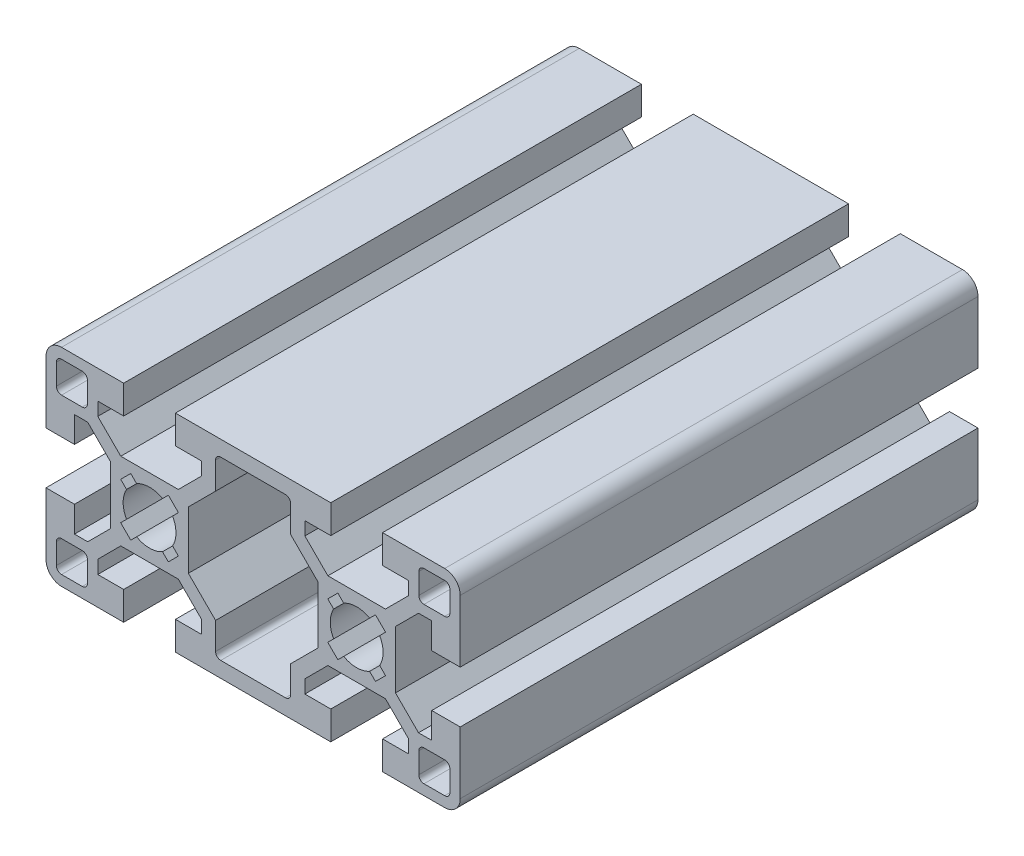
from build123d import *

# Parameters (mm, degrees)
BOSS_EXTRUDE1_DEPTH = 50


with BuildPart() as part:
    # Sketch1 → Boss-Extrude1 (new, symmetric)
    with BuildSketch(Plane.XY):
        with BuildLine():
            Line((-15, -20), (15, -20))
            Line((15, -20), (15, -14.5))
            Line((15, -14.5), (10, -14.5))
            Line((10, -14.5), (10, -11.944543648))
            Line((10, -11.944543648), (14.444543648, -7.5))
            Line((14.444543648, -7.5), (25.555456352, -7.5))
            Line((25.555456352, -7.5), (30, -11.944543648))
            Line((30, -11.944543648), (30, -14.5))
            Line((30, -14.5), (25, -14.5))
            Line((25, -14.5), (25, -20))
            Line((25, -20), (37, -20))
            ThreePointArc((37, -20), (39.121320344, -19.121320344), (40, -17))
            Line((40, -17), (40, -5))
            Line((40, -5), (34.5, -5))
            Line((34.5, -5), (34.5, -10))
            Line((34.5, -10), (31.944543648, -10))
            Line((31.944543648, -10), (27.5, -5.555456352))
            Line((27.5, -5.555456352), (27.5, 5.555456352))
            Line((27.5, 5.555456352), (31.944543648, 10))
            Line((31.944543648, 10), (34.5, 10))
            Line((34.5, 10), (34.5, 5))
            Line((34.5, 5), (40, 5))
            Line((40, 5), (40, 17))
            ThreePointArc((40, 17), (39.121320344, 19.121320344), (37, 20))
            Line((37, 20), (25, 20))
            Line((25, 20), (25, 14.5))
            Line((25, 14.5), (30, 14.5))
            Line((30, 14.5), (30, 11.944543648))
            Line((30, 11.944543648), (25.555456352, 7.5))
            Line((25.555456352, 7.5), (14.444543648, 7.5))
            Line((14.444543648, 7.5), (10, 11.944543648))
            Line((10, 11.944543648), (10, 14.5))
            Line((10, 14.5), (15, 14.5))
            Line((15, 14.5), (15, 20))
            Line((15, 20), (-15, 20))
            Line((-15, 20), (-15, 14.5))
            Line((-15, 14.5), (-10, 14.5))
            Line((-10, 14.5), (-10, 11.944543648))
            Line((-10, 11.944543648), (-14.444543648, 7.5))
            Line((-14.444543648, 7.5), (-25.555456352, 7.5))
            Line((-25.555456352, 7.5), (-30, 11.944543648))
            Line((-30, 11.944543648), (-30, 14.5))
            Line((-30, 14.5), (-25, 14.5))
            Line((-25, 14.5), (-25, 20))
            Line((-25, 20), (-37, 20))
            ThreePointArc((-37, 20), (-39.121320344, 19.121320344), (-40, 17))
            Line((-40, 17), (-40, 5))
            Line((-40, 5), (-34.5, 5))
            Line((-34.5, 5), (-34.5, 10))
            Line((-34.5, 10), (-31.944543648, 10))
            Line((-31.944543648, 10), (-27.5, 5.555456352))
            Line((-27.5, 5.555456352), (-27.5, -5.555456352))
            Line((-27.5, -5.555456352), (-31.944543648, -10))
            Line((-31.944543648, -10), (-34.5, -10))
            Line((-34.5, -10), (-34.5, -5))
            Line((-34.5, -5), (-40, -5))
            Line((-40, -5), (-40, -17))
            ThreePointArc((-40, -17), (-39.121320344, -19.121320344), (-37, -20))
            Line((-37, -20), (-25, -20))
            Line((-25, -20), (-25, -14.5))
            Line((-25, -14.5), (-30, -14.5))
            Line((-30, -14.5), (-30, -11.944543648))
            Line((-30, -11.944543648), (-25.555456352, -7.5))
            Line((-25.555456352, -7.5), (-14.444543648, -7.5))
            Line((-14.444543648, -7.5), (-10, -11.944543648))
            Line((-10, -11.944543648), (-10, -14.5))
            Line((-10, -14.5), (-15, -14.5))
            Line((-15, -14.5), (-15, -20))
        make_face()
        with BuildLine():
            Line((-38, 13), (-38, 17))
            ThreePointArc((-38, 17), (-37.707106781, 17.707106781), (-37, 18))
            Line((-37, 18), (-33, 18))
            ThreePointArc((-33, 18), (-32.292893219, 17.707106781), (-32, 17))
            Line((-32, 17), (-32, 13))
            ThreePointArc((-32, 13), (-32.292893219, 12.292893219), (-33, 12))
            Line((-33, 12), (-37, 12))
            ThreePointArc((-37, 12), (-37.707106781, 12.292893219), (-38, 13))
        make_face(mode=Mode.SUBTRACT)
        with BuildLine():
            Line((-15.555022098, -2.500434253), (-14.423651249, -3.631805103))
            Line((-14.423651249, -3.631805103), (-16.368194897, -5.576348751))
            Line((-16.368194897, -5.576348751), (-17.499565747, -4.444977902))
            ThreePointArc((-17.499565747, -4.444977902), (-20, -5.1), (-22.500434253, -4.444977902))
            Line((-22.500434253, -4.444977902), (-23.631805103, -5.576348751))
            Line((-23.631805103, -5.576348751), (-25.576348751, -3.631805103))
            Line((-25.576348751, -3.631805103), (-24.444977902, -2.500434253))
            ThreePointArc((-24.444977902, -2.500434253), (-25.1, 0), (-24.444977902, 2.500434253))
            Line((-24.444977902, 2.500434253), (-25.576348751, 3.631805103))
            Line((-25.576348751, 3.631805103), (-23.631805103, 5.576348751))
            Line((-23.631805103, 5.576348751), (-22.500434253, 4.444977902))
            ThreePointArc((-22.500434253, 4.444977902), (-20, 5.1), (-17.499565747, 4.444977902))
            Line((-17.499565747, 4.444977902), (-16.368194897, 5.576348751))
            Line((-16.368194897, 5.576348751), (-14.423651249, 3.631805103))
            Line((-14.423651249, 3.631805103), (-15.555022098, 2.500434253))
            ThreePointArc((-15.555022098, 2.500434253), (-14.9, 0), (-15.555022098, -2.500434253))
        make_face(mode=Mode.SUBTRACT)
        with BuildLine():
            Line((-38, -17), (-38, -13))
            ThreePointArc((-38, -13), (-37.707106781, -12.292893219), (-37, -12))
            Line((-37, -12), (-33, -12))
            ThreePointArc((-33, -12), (-32.292893219, -12.292893219), (-32, -13))
            Line((-32, -13), (-32, -17))
            ThreePointArc((-32, -17), (-32.292893219, -17.707106781), (-33, -18))
            Line((-33, -18), (-37, -18))
            ThreePointArc((-37, -18), (-37.707106781, -17.707106781), (-38, -17))
        make_face(mode=Mode.SUBTRACT)
        with BuildLine():
            Line((38, -13), (38, -17))
            ThreePointArc((38, -17), (37.707106781, -17.707106781), (37, -18))
            Line((37, -18), (33, -18))
            ThreePointArc((33, -18), (32.292893219, -17.707106781), (32, -17))
            Line((32, -17), (32, -13))
            ThreePointArc((32, -13), (32.292893219, -12.292893219), (33, -12))
            Line((33, -12), (37, -12))
            ThreePointArc((37, -12), (37.707106781, -12.292893219), (38, -13))
        make_face(mode=Mode.SUBTRACT)
        with BuildLine():
            Line((15.555022098, 2.500434253), (14.423651249, 3.631805103))
            Line((14.423651249, 3.631805103), (16.368194897, 5.576348751))
            Line((16.368194897, 5.576348751), (17.499565747, 4.444977902))
            ThreePointArc((17.499565747, 4.444977902), (20, 5.1), (22.500434253, 4.444977902))
            Line((22.500434253, 4.444977902), (23.631805103, 5.576348751))
            Line((23.631805103, 5.576348751), (25.576348751, 3.631805103))
            Line((25.576348751, 3.631805103), (24.444977902, 2.500434253))
            ThreePointArc((24.444977902, 2.500434253), (25.1, 0), (24.444977902, -2.500434253))
            Line((24.444977902, -2.500434253), (25.576348751, -3.631805103))
            Line((25.576348751, -3.631805103), (23.631805103, -5.576348751))
            Line((23.631805103, -5.576348751), (22.500434253, -4.444977902))
            ThreePointArc((22.500434253, -4.444977902), (20, -5.1), (17.499565747, -4.444977902))
            Line((17.499565747, -4.444977902), (16.368194897, -5.576348751))
            Line((16.368194897, -5.576348751), (14.423651249, -3.631805103))
            Line((14.423651249, -3.631805103), (15.555022098, -2.500434253))
            ThreePointArc((15.555022098, -2.500434253), (14.9, 0), (15.555022098, 2.500434253))
        make_face(mode=Mode.SUBTRACT)
        with BuildLine():
            Line((38, 17), (38, 13))
            ThreePointArc((38, 13), (37.707106781, 12.292893219), (37, 12))
            Line((37, 12), (33, 12))
            ThreePointArc((33, 12), (32.292893219, 12.292893219), (32, 13))
            Line((32, 13), (32, 17))
            ThreePointArc((32, 17), (32.292893219, 17.707106781), (33, 18))
            Line((33, 18), (37, 18))
            ThreePointArc((37, 18), (37.707106781, 17.707106781), (38, 17))
        make_face(mode=Mode.SUBTRACT)
        with BuildLine():
            Line((6.25, -17), (-6.25, -17))
            ThreePointArc((-6.25, -17), (-6.957106781, -16.707106781), (-7.25, -16))
            Line((-7.25, -16), (-7.25, -10.805456352))
            Line((-7.25, -10.805456352), (-12.5, -5.555456352))
            Line((-12.5, -5.555456352), (-12.5, 5.555456352))
            Line((-12.5, 5.555456352), (-7.25, 10.805456352))
            Line((-7.25, 10.805456352), (-7.25, 16))
            ThreePointArc((-7.25, 16), (-6.957106781, 16.707106781), (-6.25, 17))
            Line((-6.25, 17), (6.25, 17))
            ThreePointArc((6.25, 17), (6.957106781, 16.707106781), (7.25, 16))
            Line((7.25, 16), (7.25, 10.805456352))
            Line((7.25, 10.805456352), (12.5, 5.555456352))
            Line((12.5, 5.555456352), (12.5, -5.555456352))
            Line((12.5, -5.555456352), (7.25, -10.805456352))
            Line((7.25, -10.805456352), (7.25, -16))
            ThreePointArc((7.25, -16), (6.957106781, -16.707106781), (6.25, -17))
        make_face(mode=Mode.SUBTRACT)
    extrude(amount=BOSS_EXTRUDE1_DEPTH, both=True)


solid = part.part
